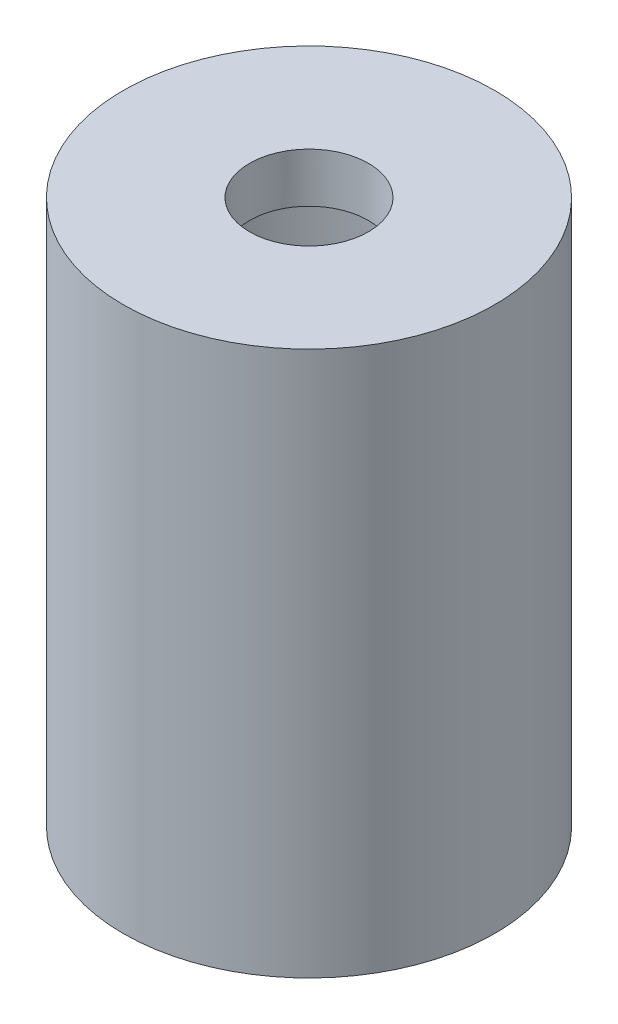
from build123d import *

# Parameters (mm, degrees)
SKETCH1_W          = 37.5
SKETCH1_H          = 110
CUT_EXTRUDE2_DEPTH = 100
CUT_EXTRUDE3_DEPTH = 139.315761936


with BuildPart() as part:
    # Sketch1 → Revolve3 (revolve)
    with BuildSketch(Plane.XY, mode=Mode.PRIVATE) as revolve3_sk:
        with Locations((18.75, 55)):
            Rectangle(SKETCH1_W, SKETCH1_H)
    revolve(revolve3_sk.sketch.rotate(Axis((37.5, 0, 0), (0, 1, 0)), 270), axis=Axis((37.5, 0, 0), (0, 1, 0)))

    # Sketch2 → Cut-Extrude2 (cut)
    with BuildSketch(Plane(origin=(0, 0, 0), x_dir=(-1, 0, 0), z_dir=(0, -1, 0))):
        with BuildLine():
            ThreePointArc((-2.5, 0), (-37.5, 35), (-72.5, 0))
            Line((-72.5, 0), (-2.5, 0))
        make_face()
        with BuildLine():
            Line((-2.5, 0), (-72.5, 0))
            ThreePointArc((-72.5, 0), (-37.5, -35), (-2.5, 0))
        make_face()
    extrude(amount=-CUT_EXTRUDE2_DEPTH, mode=Mode.SUBTRACT)

    # Sketch3 → Cut-Extrude3 (cut, through all)
    with BuildSketch(Plane(origin=(0, 110, 0), x_dir=(1, 0, 0), z_dir=(0, 1, 0))):
        with BuildLine():
            ThreePointArc((49.5, 0), (37.5, 12), (25.5, 0))
            Line((25.5, 0), (49.5, 0))
        make_face()
        with BuildLine():
            Line((49.5, 0), (25.5, 0))
            ThreePointArc((25.5, 0), (37.5, -12), (49.5, 0))
        make_face()
    extrude(amount=-CUT_EXTRUDE3_DEPTH, mode=Mode.SUBTRACT)


solid = part.part
